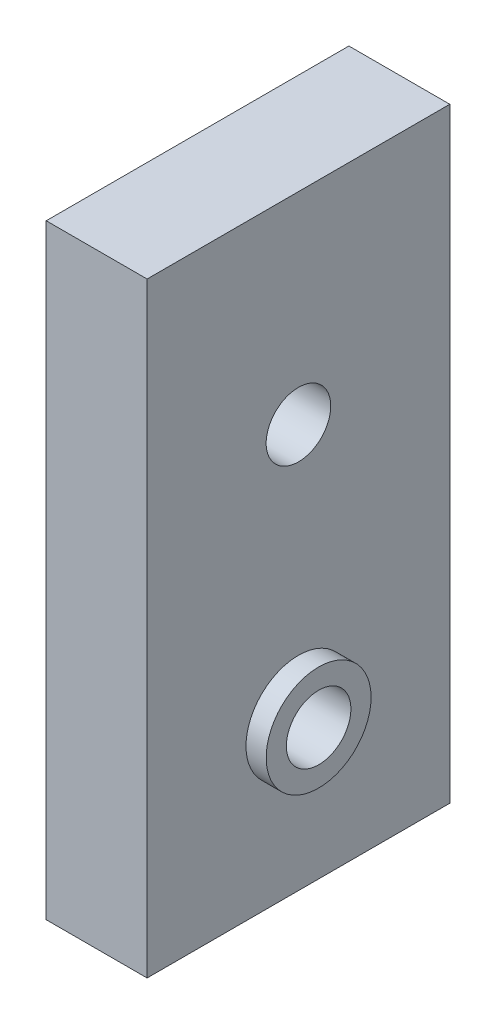
from build123d import *
from build123d.topology import SkipClean

# Parameters (mm, degrees)
BOSS_EXTRUDE1_DEPTH = 5
SKETCH2_R           = 2.6
SKETCH2_R_2         = 1.6
EXTRUDE_THIN1_DEPTH = 1


with BuildPart() as part:
    # Sketch1 → Boss-Extrude1 (new body)
    with BuildSketch(Plane(origin=(0, 0, 0), x_dir=(0, 0, -1), z_dir=(1, 0, 0))):
        with BuildLine():
            Line((15, 30), (7.5, 30))
            Line((7.5, 30), (7.5, 21.6))
            ThreePointArc((7.5, 21.6), (8.63137085, 21.13137085), (9.1, 20))
            ThreePointArc((9.1, 20), (8.63137085, 18.86862915), (7.5, 18.4))
            Line((7.5, 18.4), (7.5, 9.1))
            ThreePointArc((7.5, 9.1), (8.63137085, 8.63137085), (9.1, 7.5))
            ThreePointArc((9.1, 7.5), (8.63137085, 6.36862915), (7.5, 5.9))
            Line((7.5, 5.9), (7.5, 0))
            Line((7.5, 0), (15, 0))
            Line((15, 0), (15, 30))
        make_face()
        with BuildLine():
            Line((7.5, 21.6), (7.5, 30))
            Line((7.5, 30), (0, 30))
            Line((0, 30), (0, 0))
            Line((0, 0), (7.5, 0))
            Line((7.5, 0), (7.5, 5.9))
            ThreePointArc((7.5, 5.9), (5.9, 7.5), (7.5, 9.1))
            Line((7.5, 9.1), (7.5, 18.4))
            ThreePointArc((7.5, 18.4), (5.9, 20), (7.5, 21.6))
        make_face()
    extrude(amount=BOSS_EXTRUDE1_DEPTH)

    # Sketch2 → Extrude-Thin1 (add)
    with SkipClean():  # the faces are left unmerged after this step: merging them gives an invalid solid
        with BuildSketch(Plane(origin=(5, 0, 0), x_dir=(0, 0, -1), z_dir=(1, 0, 0))):
            with Locations((7.5, 7.5)):
                Circle(SKETCH2_R)
            with Locations((7.5, 7.5)):
                Circle(SKETCH2_R_2, mode=Mode.SUBTRACT)
        extrude(amount=EXTRUDE_THIN1_DEPTH)


solid = part.part
